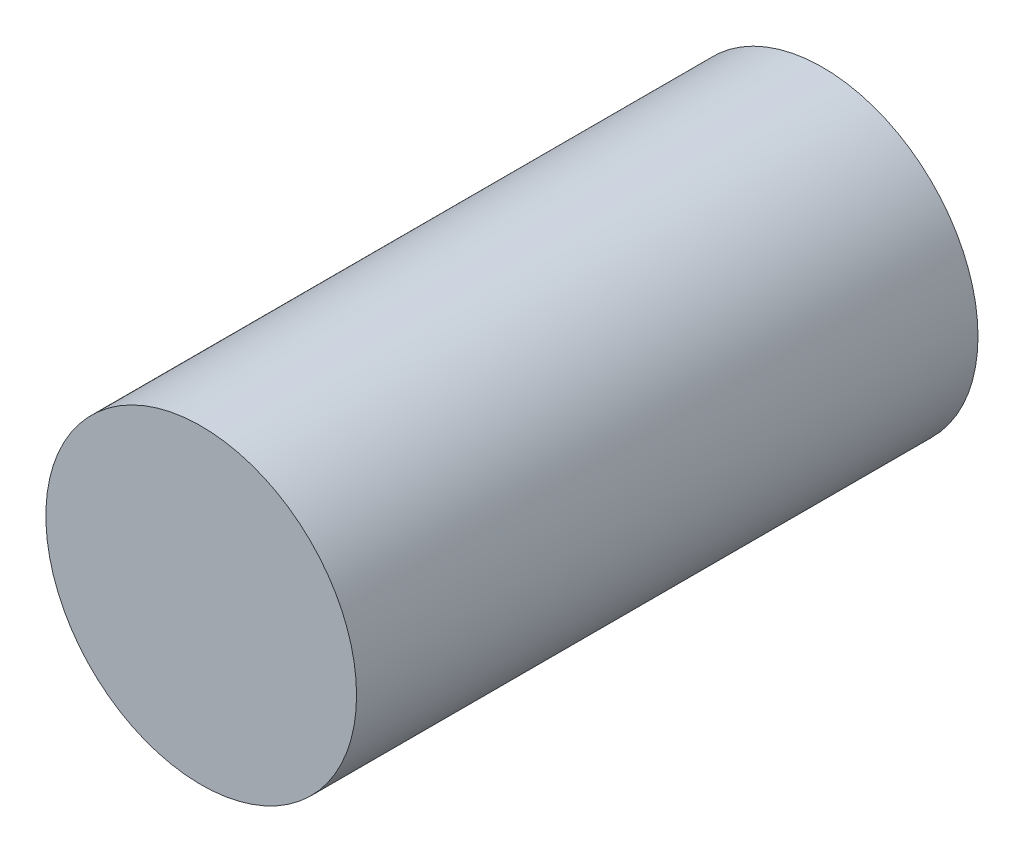
from build123d import *

# Parameters (mm, degrees)
CROQUIS1_R              = 1
SALIENTE_EXTRUIR1_DEPTH = 4


with BuildPart() as part:
    # Croquis1 → Saliente-Extruir1 (new body)
    with BuildSketch(Plane.XY):
        Circle(CROQUIS1_R)
    extrude(amount=SALIENTE_EXTRUIR1_DEPTH)


solid = part.part
